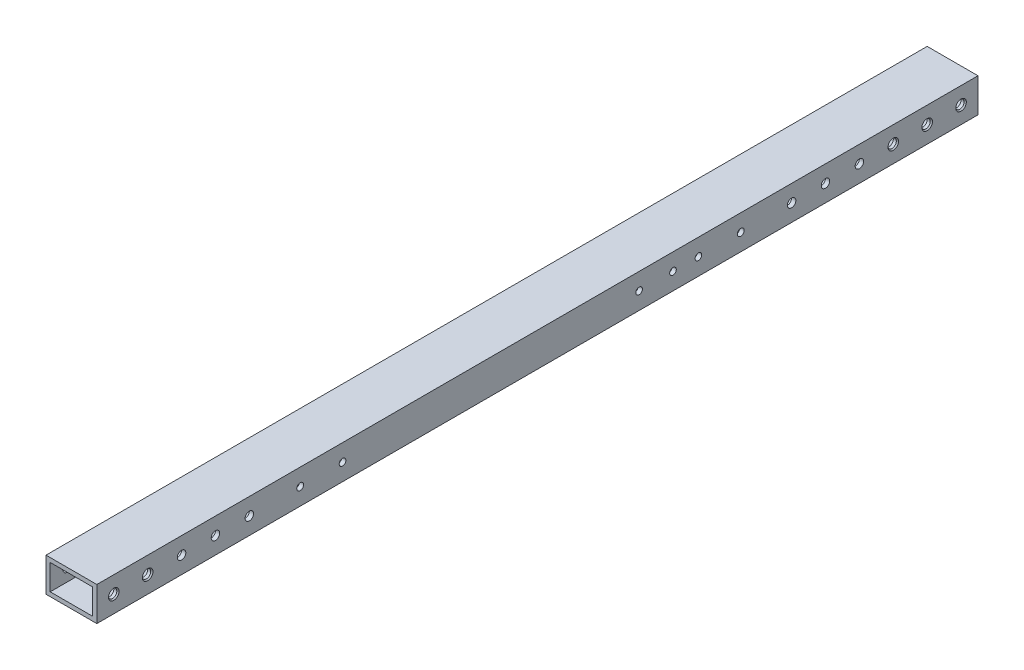
from build123d import *

# Parameters (mm, degrees)
BOSS_EXTRUDE1_DEPTH                  = 330.200001
BOSS_EXTRUDE1_DEPTH_BACK             = 330.200001
SKETCH3_W                            = 38.1
SKETCH3_H                            = 25.4
SKETCH3_W_2                          = 31.75
SKETCH3_H_2                          = 19.05
F_1_4_0_25_DIAMETER_HOLE2_AT_2_COUNT = 2
F_1_4_0_25_DIAMETER_HOLE2_AT_2_PITCH = 25.4
F_1_4_0_25_DIAMETER_HOLE2_AT_3_COUNT = 2
F_1_4_0_25_DIAMETER_HOLE2_AT_3_PITCH = 635.000000508
F_1_4_0_25_DIAMETER_HOLE2_AT_4_COUNT = 2
F_1_4_0_25_DIAMETER_HOLE2_AT_4_PITCH = 50.8
F_1_4_0_25_DIAMETER_HOLE2_AT_5_COUNT = 2
F_1_4_0_25_DIAMETER_HOLE2_AT_5_PITCH = 609.600000508
F_1_4_0_25_DIAMETER_HOLE3_D          = 6.35
F_13_64_0_20313_DIAMETER_HOLE1_D     = 5.159502
F_10_CLEARANCE_HOLE1_D               = 4.9784


with BuildPart() as part:
    # Sketch3 → Boss-Extrude1 (new, two sides: drawn at the far end of the back side and taken through both)
    with BuildSketch(Plane.XY.offset(-BOSS_EXTRUDE1_DEPTH_BACK)):
        Rectangle(SKETCH3_W, SKETCH3_H)
        Rectangle(SKETCH3_W_2, SKETCH3_H_2, mode=Mode.SUBTRACT)
    extrude(amount=BOSS_EXTRUDE1_DEPTH + BOSS_EXTRUDE1_DEPTH_BACK)

    # Sketch8 → 1/4 (0.25) Diameter Hole2 (revolve, cut)
    with BuildSketch(Plane(origin=(-19.05, 0, -317.500000508), x_dir=(0, 0, 1), z_dir=(0, 1, 0))):
        Polygon((0, 0), (0, 38.1), (3.9624, 38.1), (3.175, 37.194199916), (3.175, 0), align=None)
    f_1_4_0_25_diameter_hole2 = revolve(axis=Axis((-25.4, 0, -317.500000508), (1, 0, 0)), mode=Mode.SUBTRACT)

    # 1/4 (0.25) Diameter Hole2 at 2: 1/4 (0.25) Diameter Hole2 ×2
    with Locations(*[(0, 0, i * F_1_4_0_25_DIAMETER_HOLE2_AT_2_PITCH) for i in range(1, F_1_4_0_25_DIAMETER_HOLE2_AT_2_COUNT)]):
        add(f_1_4_0_25_diameter_hole2, mode=Mode.SUBTRACT)

    # 1/4 (0.25) Diameter Hole2 at 3: 1/4 (0.25) Diameter Hole2 ×2
    with Locations(*[(0, 0, i * F_1_4_0_25_DIAMETER_HOLE2_AT_3_PITCH) for i in range(1, F_1_4_0_25_DIAMETER_HOLE2_AT_3_COUNT)]):
        add(f_1_4_0_25_diameter_hole2, mode=Mode.SUBTRACT)

    # 1/4 (0.25) Diameter Hole2 at 4: 1/4 (0.25) Diameter Hole2 ×2
    with Locations(*[(0, 0, i * F_1_4_0_25_DIAMETER_HOLE2_AT_4_PITCH) for i in range(1, F_1_4_0_25_DIAMETER_HOLE2_AT_4_COUNT)]):
        add(f_1_4_0_25_diameter_hole2, mode=Mode.SUBTRACT)

    # 1/4 (0.25) Diameter Hole2 at 5: 1/4 (0.25) Diameter Hole2 ×2
    with Locations(*[(0, 0, i * F_1_4_0_25_DIAMETER_HOLE2_AT_5_PITCH) for i in range(1, F_1_4_0_25_DIAMETER_HOLE2_AT_5_COUNT)]):
        add(f_1_4_0_25_diameter_hole2, mode=Mode.SUBTRACT)

    # 1/4 (0.25) Diameter Hole3 (through all)
    with Locations(Plane(origin=(19.05, 0, 0), x_dir=(0, 0, -1), z_dir=(1, 0, 0))):
        with Locations((-266.7, 0), (-241.3, 0), (-215.9, 0), (241.300000508, 0), (215.900000508, 0), (190.500000508, 0)):
            Hole(F_1_4_0_25_DIAMETER_HOLE3_D / 2)

    # 13/64 (0.20313) Diameter Hole1 (through all)
    with Locations(Plane(origin=(19.05, 0, 0), x_dir=(0, 0, -1), z_dir=(1, 0, 0))):
        with Locations((152.4, 0), (-177.8, 0)):
            Hole(F_13_64_0_20313_DIAMETER_HOLE1_D / 2)

    # #10 Clearance Hole1 (through all)
    with Locations(Plane.ZY.offset(19.05)):
        with Locations((-120.650000508, 0), (146.05, 0), (-101.600001475, 6.6e-07), (-76.200001475, 5.86e-07)):
            Hole(F_10_CLEARANCE_HOLE1_D / 2)


solid = part.part
